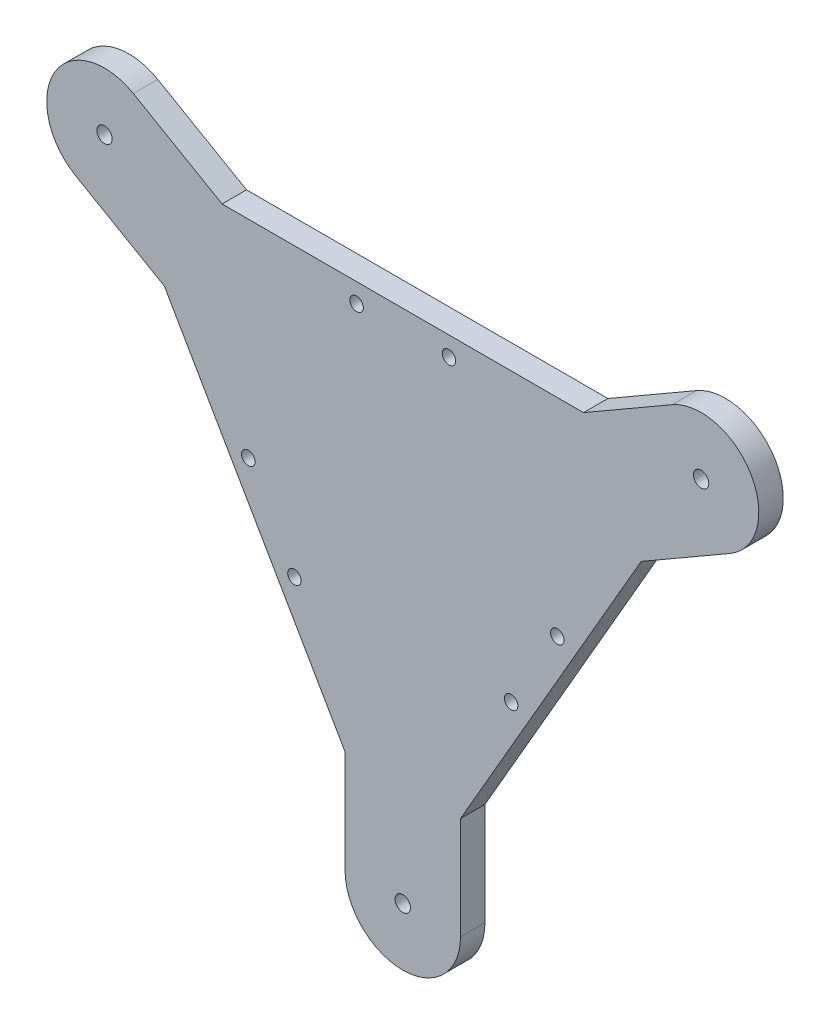
from build123d import *

# Parameters (mm, degrees)
BOSS_EXTRU_1_DEPTH      = 6.35
ENL_V_MAT_EXTRU_2_DEPTH = 144.087124508
ESQUISSE5_R             = 1.75
ENL_V_MAT_EXTRU_3_DEPTH = 100.149703595
BOSS_EXTRU_2_DEPTH      = 6.35
ESQUISSE11_R            = 2
ENL_V_MAT_EXTRU_4_DEPTH = 138.111345481


with BuildPart() as part:
    # Esquisse2 → Boss.-Extru.1 (new body)
    with BuildSketch(Plane.XY):
        Polygon((-71.473076574, 0), (71.473076574, 0), (0, 123.795), align=None)
    extrude(amount=BOSS_EXTRU_1_DEPTH)

    # Esquisse4 → Enlèv. mat.-Extru.2 (cut, through all)
    with BuildSketch(Plane.XY.offset(6.35)):
        Polygon((-71.473076574, 0), (-49.473076574, 38.105117767), (-27.473076574, 0), align=None)
        Polygon((71.473076574, 0), (27.473076574, 0), (49.473076574, 38.105117767), align=None)
        Polygon((0, 123.795), (-22, 85.689882233), (22, 85.689882233), align=None)
    extrude(amount=-ENL_V_MAT_EXTRU_2_DEPTH, mode=Mode.SUBTRACT)

    # Esquisse5 → Enlèv. mat.-Extru.3 (cut, through all)
    with BuildSketch(Plane.XY.offset(6.35)):
        with Locations((-40.142949555, 31.944863729)):
            Circle(ESQUISSE5_R)
        with Locations((-28.142949555, 11.160254038)):
            Circle(ESQUISSE5_R)
        with Locations((28.142949555, 11.160254038)):
            Circle(ESQUISSE5_R)
        with Locations((40.142949555, 31.944863729)):
            Circle(ESQUISSE5_R)
        with Locations((-12, 80.689882233)):
            Circle(ESQUISSE5_R)
        with Locations((12, 80.689882233)):
            Circle(ESQUISSE5_R)
    extrude(amount=-ENL_V_MAT_EXTRU_3_DEPTH, mode=Mode.SUBTRACT)

    # Esquisse10 → Boss.-Extru.2 (add)
    with BuildSketch(Plane(origin=(0, 0, 0), x_dir=(-1, 0, 0), z_dir=(0, 0, -1))):
        with BuildLine():
            Line((49.473076574, 38.105117767), (61.946156702, 59.709120804))
            Line((61.946156702, 59.709120804), (85.000000578, 73.019265173))
            ThreePointArc((85.000000578, 73.019265173), (90.4903807, 93.50964648), (69.999999393, 99.000026602))
            Line((69.999999393, 99.000026602), (46.946155518, 85.689882233))
            Line((46.946155518, 85.689882233), (22, 85.689882233))
            Line((22, 85.689882233), (49.473076574, 38.105117767))
        make_face()
        with BuildLine():
            Line((-22, 85.689882233), (-46.946155518, 85.689882233))
            Line((-46.946155518, 85.689882233), (-69.999999408, 99.000026577))
            ThreePointArc((-69.999999408, 99.000026577), (-90.490381043, 93.509645854), (-84.999999408, 73.019264463))
            Line((-84.999999408, 73.019264463), (-61.946154333, 59.709122172))
            Line((-61.946154333, 59.709122172), (-49.473076574, 38.105117767))
            Line((-49.473076574, 38.105117767), (-22, 85.689882233))
        make_face()
        with BuildLine():
            Line((-27.473076574, 0), (-15, -21.604005089))
            Line((-15, -21.604005089), (-15, -48.224291724))
            ThreePointArc((-15, -48.224291724), (0, -63.224291724), (15, -48.224291724))
            Line((15, -48.224291724), (15, -21.604005089))
            Line((15, -21.604005089), (27.473076574, 0))
            Line((27.473076574, 0), (-27.473076574, 0))
        make_face()
    extrude(amount=-BOSS_EXTRU_2_DEPTH)

    # Esquisse11 → Enlèv. mat.-Extru.4 (cut, through all)
    with BuildSketch(Plane.XY.offset(6.35)):
        with Locations((-77.5, 86.009645862)):
            Circle(ESQUISSE11_R)
        with Locations((77.5, 86.009645862)):
            Circle(ESQUISSE11_R)
        with Locations((0, -48.224291724)):
            Circle(ESQUISSE11_R)
    extrude(amount=-ENL_V_MAT_EXTRU_4_DEPTH, mode=Mode.SUBTRACT)


solid = part.part
